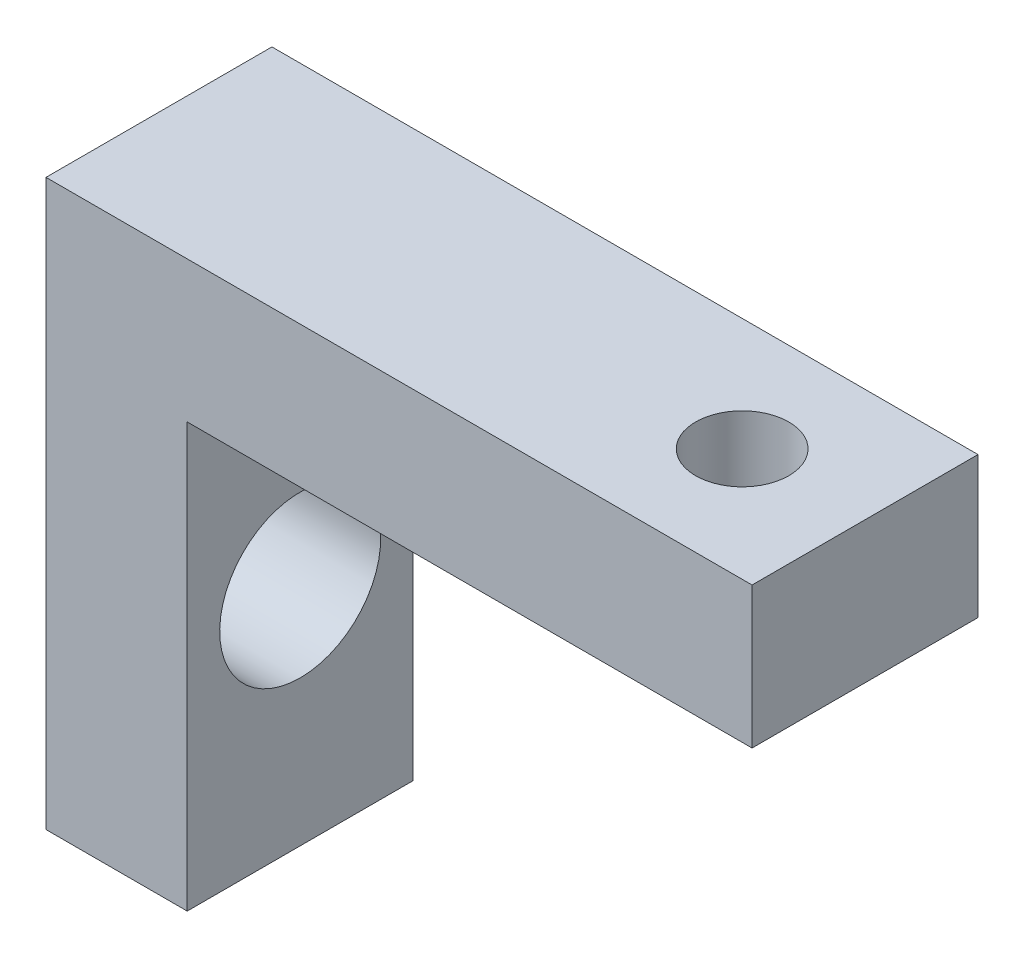
from build123d import *

# Parameters (mm, degrees)
EXTRUDE_1_DEPTH     = 8
SKETCH_2_R          = 1.65
CUT_EXTRUDE_1_DEPTH = 8
SKETCH_3_R          = 2.85
CUT_EXTRUDE_2_DEPTH = 8


with BuildPart() as part:
    # 草图1 → 凸台-拉伸1 (new body)
    with BuildSketch(Plane.XY):
        Polygon((0, 0), (0, -15), (-5, -15), (-5, 5), (20, 5), (20, 0), align=None)
    extrude(amount=EXTRUDE_1_DEPTH)

    # 草图2 → 切除-拉伸1 (cut)
    with BuildSketch(Plane.XZ):
        with Locations((15.65, 4)):
            Circle(SKETCH_2_R)
    extrude(amount=-CUT_EXTRUDE_1_DEPTH, mode=Mode.SUBTRACT)

    # 草图3 → 切除-拉伸2 (cut)
    with BuildSketch(Plane.ZY.offset(5)):
        with Locations(Location((4, -7, 0), (0, 0, 270))):
            Circle(SKETCH_3_R)
    extrude(amount=-CUT_EXTRUDE_2_DEPTH, mode=Mode.SUBTRACT)


solid = part.part
